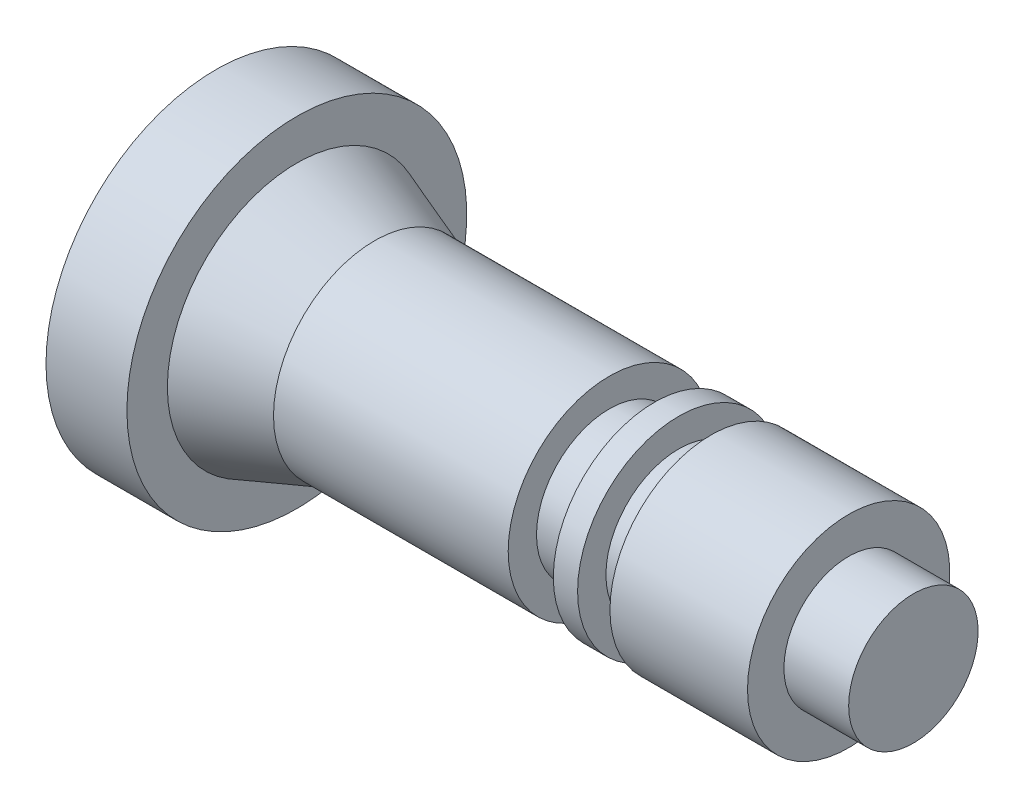
from build123d import *


with BuildPart() as part:
    # Sketch1 → Revolve1 (revolve)
    with BuildSketch(Plane.XY, mode=Mode.PRIVATE) as revolve1_sk:
        Polygon((0, 0), (0, 21), (10, 21), (10, 16), (19.616170968, 12.5), (48.619466381, 12.5), (48.619466381, 9), (54.197023191, 9), (54.197023191, 12.5), (57.197023191, 12.5), (57.197023191, 9), (61.197023191, 9), (61.197023191, 12.5), (78.197023191, 12.5), (78.197023191, 8), (86.197023191, 8), (86.197023191, 0), align=None)
    revolve(revolve1_sk.sketch.rotate(Axis((0, 0, 0), (1, 0, 0)), 90), axis=Axis((0, 0, 0), (1, 0, 0)))


solid = part.part
